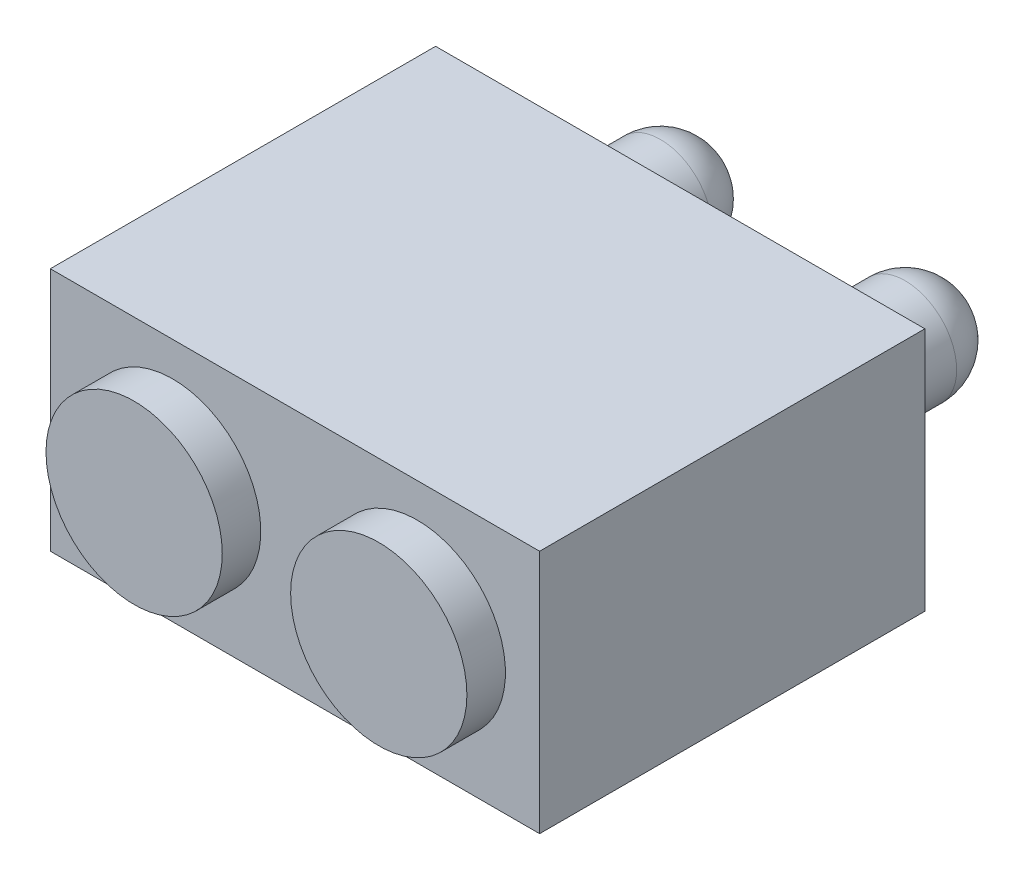
from build123d import *

# Parameters (mm, degrees)
ESQUISSE1_W       = 5.08
ESQUISSE1_H       = 2.54
EXTRUSION1_DEPTH  = 4
ESQUISSE2_R       = 0.915
EXTRUSION2_DEPTH  = 0.4
ESQUISSE3_R       = 0.535
EXTRUSION3_DEPTH  = 1.065
D_ME1_FACE_RADIUS = 0.535
D_ME1_HEIGHT      = 0.535
D_ME2_FACE_RADIUS = 0.535
D_ME2_HEIGHT      = 0.535


with BuildPart() as part:
    # Esquisse1 → Extrusion1 (new body)
    with BuildSketch(Plane.XY):
        with Locations((2.54, 1.27)):
            Rectangle(ESQUISSE1_W, ESQUISSE1_H)
    extrude(amount=EXTRUSION1_DEPTH)

    # Esquisse2 → Extrusion2 (add)
    with BuildSketch(Plane.XY.offset(4)):
        with Locations(Location((3.81, 1.27, 0), (0, 0, 180))):
            Circle(ESQUISSE2_R)
        with Locations(Location((1.27, 1.27, 0), (0, 0, 180))):
            Circle(ESQUISSE2_R)
    extrude(amount=EXTRUSION2_DEPTH)

    # Esquisse3 → Extrusion3 (add)
    with BuildSketch(Plane(origin=(0, 0, 0), x_dir=(-1, 0, 0), z_dir=(0, 0, -1))):
        with Locations((-3.81, 1.27)):
            Circle(ESQUISSE3_R)
        with Locations((-1.27, 1.27)):
            Circle(ESQUISSE3_R)
    extrude(amount=EXTRUSION3_DEPTH)

    # Dôme1: a dome of height H over a round flat face of radius A is a cap of a sphere of radius (A * A + H * H) / (2 * H)
    d_me1_r = (D_ME1_FACE_RADIUS * D_ME1_FACE_RADIUS + D_ME1_HEIGHT * D_ME1_HEIGHT) / (2 * D_ME1_HEIGHT)
    d_me1_base = Plane((3.81, 1.27, -1.065), z_dir=(0, 0, -1))
    with Locations(d_me1_base.offset(D_ME1_HEIGHT - d_me1_r)):
        d_me1_ball = Sphere(d_me1_r, mode=Mode.PRIVATE)
    add(split(d_me1_ball, bisect_by=d_me1_base, keep=Keep.TOP, mode=Mode.PRIVATE))

    # Dôme2: a dome of height H over a round flat face of radius A is a cap of a sphere of radius (A * A + H * H) / (2 * H)
    d_me2_r = (D_ME2_FACE_RADIUS * D_ME2_FACE_RADIUS + D_ME2_HEIGHT * D_ME2_HEIGHT) / (2 * D_ME2_HEIGHT)
    d_me2_base = Plane((1.27, 1.27, -1.065), z_dir=(0, 0, -1))
    with Locations(d_me2_base.offset(D_ME2_HEIGHT - d_me2_r)):
        d_me2_ball = Sphere(d_me2_r, mode=Mode.PRIVATE)
    add(split(d_me2_ball, bisect_by=d_me2_base, keep=Keep.TOP, mode=Mode.PRIVATE))


solid = part.part
